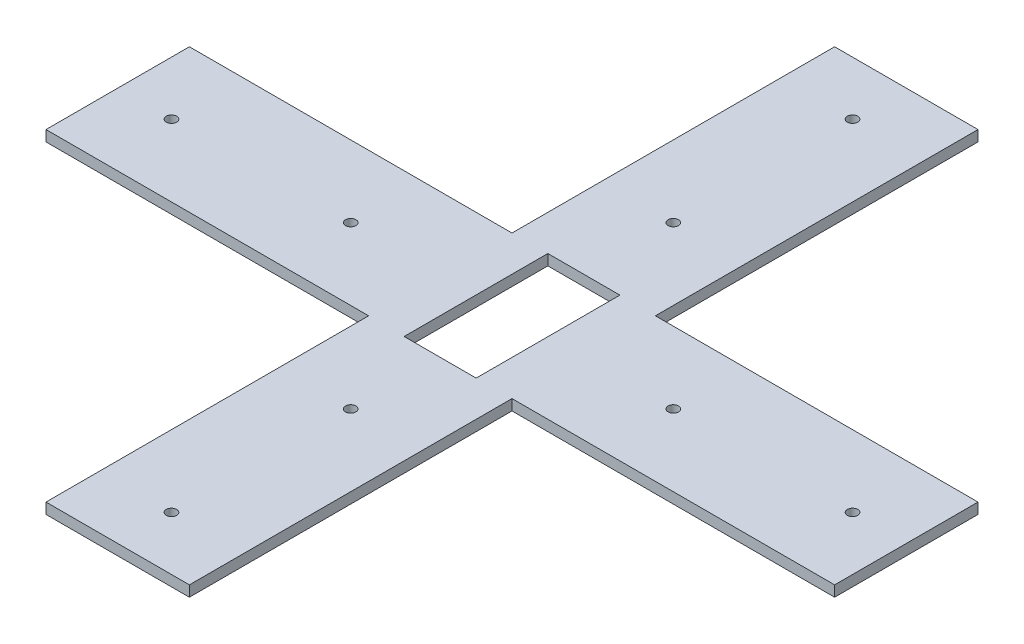
from build123d import *

# Parameters (mm, degrees)
SKETCH1_R           = 1.45
SKETCH1_W           = 20.1
SKETCH1_H           = 40.1
BOSS_EXTRUDE1_DEPTH = 3


with BuildPart() as part:
    # Sketch1 → Boss-Extrude1 (new body)
    with BuildSketch(Plane(origin=(0, 0, 0), x_dir=(1, 0, 0), z_dir=(0, 1, 0))):
        Polygon((-20, 110), (20, 110), (20, 20), (110, 20), (110, -20), (20, -20), (20, -110), (-20, -110), (-20, -20), (-110, -20), (-110, 20), (-20, 20), align=None)
        with Locations(Location((45, 0, 0), (0, 0, 270))):
            Circle(SKETCH1_R, mode=Mode.SUBTRACT)
        with Locations(Location((95, 0, 0), (0, 0, 270))):
            Circle(SKETCH1_R, mode=Mode.SUBTRACT)
        with Locations(Location((-95, 0, 0), (0, 0, 270))):
            Circle(SKETCH1_R, mode=Mode.SUBTRACT)
        with Locations(Location((-45, 0, 0), (0, 0, 270))):
            Circle(SKETCH1_R, mode=Mode.SUBTRACT)
        with Locations(Location((0, 95, 0), (0, 0, 270))):
            Circle(SKETCH1_R, mode=Mode.SUBTRACT)
        with Locations(Location((0, 45, 0), (0, 0, 270))):
            Circle(SKETCH1_R, mode=Mode.SUBTRACT)
        with Locations(Location((0, -45, 0), (0, 0, 270))):
            Circle(SKETCH1_R, mode=Mode.SUBTRACT)
        with Locations(Location((0, -95, 0), (0, 0, 270))):
            Circle(SKETCH1_R, mode=Mode.SUBTRACT)
        Rectangle(SKETCH1_W, SKETCH1_H, mode=Mode.SUBTRACT)
    extrude(amount=BOSS_EXTRUDE1_DEPTH)


solid = part.part
